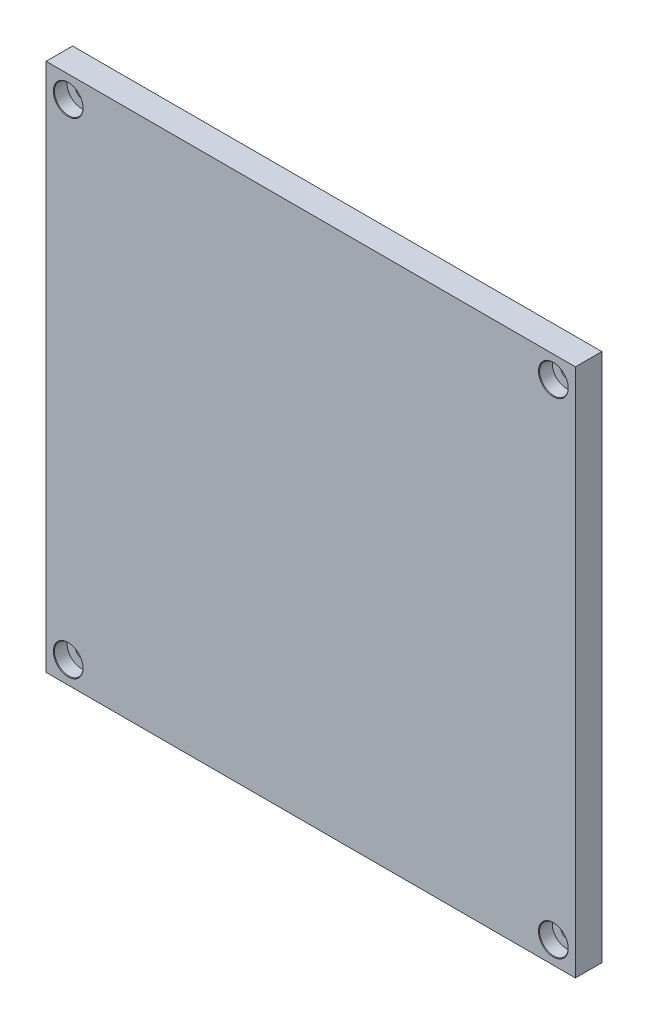
from build123d import *

# Parameters (mm, degrees)
SKETCH1_W           = 120
SKETCH1_H           = 120
BOSS_EXTRUDE1_DEPTH = 6


with BuildPart() as part:
    # Sketch1 → Boss-Extrude1 (new body)
    with BuildSketch(Plane(origin=(0, 0, 0), x_dir=(0, 1, 0), z_dir=(0, 0, 1))):
        Rectangle(SKETCH1_W, SKETCH1_H)
    extrude(amount=BOSS_EXTRUDE1_DEPTH)

    # Sketch7 → CBORE for M3 SBHCS1 (revolve, cut)
    with BuildSketch(Plane(origin=(-55, 55, 6), x_dir=(0, -1, 0), z_dir=(1, 0, 0))):
        Polygon((0, 0), (0, 6), (1.25, 6), (1.25, 3), (3.25, 3), (3.25, 0.125), (3.375, 0), align=None)
    cbore_for_m3_sbhcs1 = revolve(axis=Axis((-55, 55, 12.35), (0, 0, -1)), mode=Mode.SUBTRACT)

    # Mirror2: CBORE for M3 SBHCS1 across plane
    add(cbore_for_m3_sbhcs1.mirror(Plane(origin=(0, 0, 0), x_dir=(0, 0, 1), z_dir=(1, 0, 0))), mode=Mode.SUBTRACT)

    # Mirror2 at the second plane: CBORE for M3 SBHCS1 across plane
    add(cbore_for_m3_sbhcs1.mirror(Plane.ZX), mode=Mode.SUBTRACT)

    # Mirror2 at the second plane copy 1 sketc → Mirror2 at the second plane copy 1 (revolve, cut)
    with BuildSketch(Plane(origin=(55, -55, 6), x_dir=(0, 1, 0), z_dir=(-1, 0, 0))):
        Polygon((0, 0), (0, 6), (1.25, 6), (1.25, 3), (3.25, 3), (3.25, 0.125), (3.375, 0), align=None)
    revolve(axis=Axis((55, -55, 12.35), (0, 0, -1)), mode=Mode.SUBTRACT)


solid = part.part
